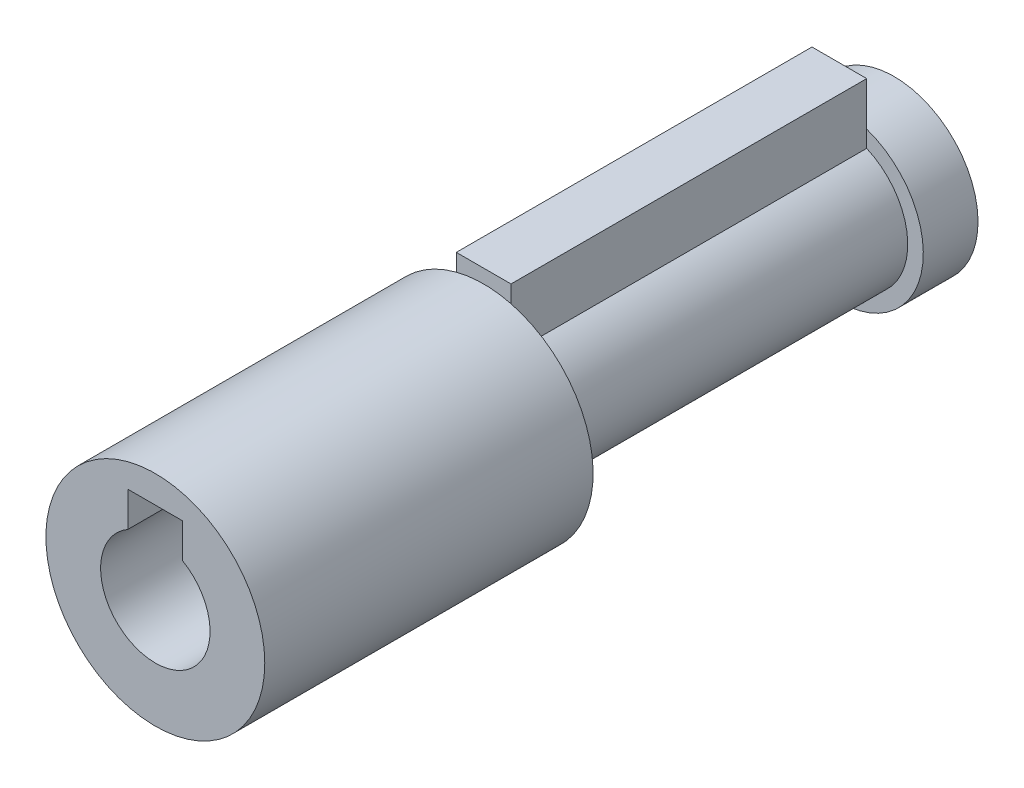
from build123d import *

# Parameters (mm, degrees)
SKETCH1_R           = 5.08
BOSS_EXTRUDE1_DEPTH = 12.7
BOSS_EXTRUDE5_START = 2.54
SKETCH3_R           = 5.08
BOSS_EXTRUDE5_DEPTH = 2.54
BOSS_EXTRUDE7_DEPTH = 16.51
SKETCH6_R           = 3.897142563
BOSS_EXTRUDE8_DEPTH = 2.54


with BuildPart() as part:
    # Sketch1 → Boss-Extrude1 (new body)
    with BuildSketch(Plane.XY):
        Circle(SKETCH1_R)
        with BuildLine():
            Line((-1.27, 2.199704526), (-1.27, 3.81))
            Line((-1.27, 3.81), (1.27, 3.81))
            Line((1.27, 3.81), (1.27, 2.199704526))
            ThreePointArc((1.27, 2.199704526), (2.199704526, 1.27), (2.54, 0))
            ThreePointArc((2.54, 0), (-1.27, -2.199704526), (-1.27, 2.199704526))
        make_face(mode=Mode.SUBTRACT)
    extrude(amount=BOSS_EXTRUDE1_DEPTH)

    # Sketch3 → Boss-Extrude5 (add)
    with BuildSketch(Plane(origin=(0, 0, 0), x_dir=(-1, 0, 0), z_dir=(0, 0, -1)).offset(BOSS_EXTRUDE5_START)):
        Circle(SKETCH3_R)
    extrude(amount=-BOSS_EXTRUDE5_DEPTH)

    # Sketch5 → Boss-Extrude7 (add)
    with BuildSketch(Plane(origin=(0, 0, -2.54), x_dir=(-1, 0, 0), z_dir=(0, 0, -1))):
        with BuildLine():
            Line((-1.27, 5.715), (1.27, 5.715))
            Line((1.27, 5.715), (1.27, 2.909935566))
            ThreePointArc((1.27, 2.909935566), (0, -3.175), (-1.27, 2.909935566))
            Line((-1.27, 2.909935566), (-1.27, 5.715))
        make_face()
    extrude(amount=BOSS_EXTRUDE7_DEPTH)

    # Sketch6 → Boss-Extrude8 (add)
    with BuildSketch(Plane(origin=(0, 0, -19.05), x_dir=(-1, 0, 0), z_dir=(0, 0, -1))):
        with Locations(Location((0, 0, 0), (0, 0, 109.018885315))):
            Circle(SKETCH6_R)
    extrude(amount=BOSS_EXTRUDE8_DEPTH)


solid = part.part
